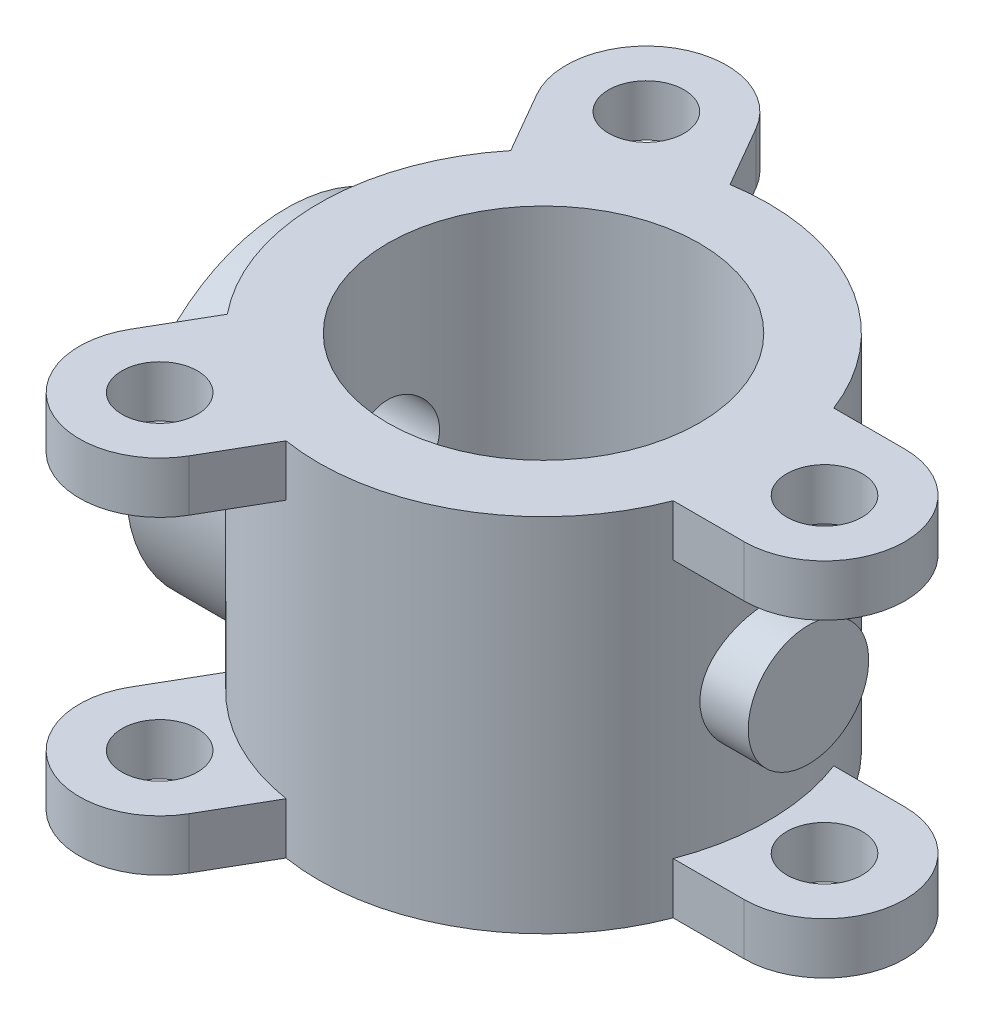
from build123d import *

# Parameters (mm, degrees)
SKETCH1_R               = 23.5
BOSS_EXTRUDE1_DEPTH     = 112.5
SKETCH2_OUTSIDE_W       = 484.702
SKETCH2_OUTSIDE_H       = 522.81
SKETCH2_OUTSIDE_R       = 140
CUT_EXTRUDE2_DEPTH      = 80.5
SKETCH3_R               = 100
BOSS_EXTRUDE2_DEPTH     = 160
SKETCH5_R               = 37.5
BOSS_EXTRUDE3_DEPTH     = 325
SKETCH6_R               = 28.1
CUT_EXTRUDE3_DEPTH      = 310
SKETCH7_R               = 50
CUT_EXTRUDE4_DEPTH      = 25
SKETCH8_R               = 10.15
CUT_EXTRUDE5_DEPTH      = 15
CUT_EXTRUDE6_DEPTH      = 323.343674653
CUT_EXTRUDE6_DEPTH_BACK = 323.343674653
SKETCH9_R               = 97


with BuildPart() as part:
    # Sketch1 → Boss-Extrude1 (new, symmetric)
    with BuildSketch(Plane(origin=(0, 0, 0), x_dir=(1, 0, 0), z_dir=(0, 1, 0))):
        with BuildLine():
            Line((175, 50), (130.766968306, 50))
            ThreePointArc((130.766968306, 50), (70, 121.24355653), (-22.082213964, 138.247516529))
            Line((-22.082213964, 138.247516529), (-44.198729811, 176.554445662))
            ThreePointArc((-44.198729811, 176.554445662), (-112.5, 194.855715852), (-130.801270189, 126.554445662))
            Line((-130.801270189, 126.554445662), (-108.684754342, 88.247516529))
            ThreePointArc((-108.684754342, 88.247516529), (-140, 0), (-108.684754342, -88.247516529))
            Line((-108.684754342, -88.247516529), (-130.801270189, -126.554445662))
            ThreePointArc((-130.801270189, -126.554445662), (-112.5, -194.855715851), (-44.198729811, -176.554445662))
            Line((-44.198729811, -176.554445662), (-22.082213964, -138.247516529))
            ThreePointArc((-22.082213964, -138.247516529), (70, -121.24355653), (130.766968306, -50))
            Line((130.766968306, -50), (175, -50))
            ThreePointArc((175, -50), (225, 0), (175, 50))
        make_face()
        with Locations(Location((175, 0, 0), (0, 0, 270))):
            Circle(SKETCH1_R, mode=Mode.SUBTRACT)
        with Locations(Location((-87.5, 151.554445662, 0), (0, 0, 270))):
            Circle(SKETCH1_R, mode=Mode.SUBTRACT)
        with Locations(Location((-87.5, -151.554445662, 0), (0, 0, 270))):
            Circle(SKETCH1_R, mode=Mode.SUBTRACT)
    extrude(amount=BOSS_EXTRUDE1_DEPTH, both=True)

    # Sketch2 outside → Cut-Extrude2 (cut, symmetric)
    with BuildSketch(Plane(origin=(0, 0, 0), x_dir=(1, 0, 0), z_dir=(0, 1, 0))):
        with Locations((42.5, 0)):
            Rectangle(SKETCH2_OUTSIDE_W, SKETCH2_OUTSIDE_H)
        with Locations(Location((0, 0, 0), (0, 0, 99.075167572))):
            Circle(SKETCH2_OUTSIDE_R, mode=Mode.SUBTRACT)
    extrude(amount=CUT_EXTRUDE2_DEPTH, both=True, mode=Mode.SUBTRACT)

    # Sketch3 → Boss-Extrude2 (add)
    with BuildSketch(Plane(origin=(0, 0, 0), x_dir=(0, 0, -1), z_dir=(1, 0, 0))):
        Circle(SKETCH3_R)
    extrude(amount=-BOSS_EXTRUDE2_DEPTH)

    # Sketch5 → Boss-Extrude3 (add)
    with BuildSketch(Plane.ZY.offset(160)):
        Circle(SKETCH5_R)
    extrude(amount=-BOSS_EXTRUDE3_DEPTH)

    # Sketch6 → Cut-Extrude3 (cut)
    with BuildSketch(Plane.ZY.offset(160)):
        Circle(SKETCH6_R)
    extrude(amount=-CUT_EXTRUDE3_DEPTH, mode=Mode.SUBTRACT)

    # Sketch7 → Cut-Extrude4 (cut)
    with BuildSketch(Plane.ZY.offset(160)):
        Circle(SKETCH7_R)
    extrude(amount=-CUT_EXTRUDE4_DEPTH, mode=Mode.SUBTRACT)

    # Sketch8 → Cut-Extrude5 (cut)
    with BuildSketch(Plane.ZY.offset(160)):
        with Locations((0, 74.921014489)):
            Circle(SKETCH8_R)
        with Locations((64.951905284, -37.578985511)):
            Circle(SKETCH8_R)
        with Locations((-64.951905284, -37.578985511)):
            Circle(SKETCH8_R)
    extrude(amount=-CUT_EXTRUDE5_DEPTH, mode=Mode.SUBTRACT)

    # Sketch9 → Cut-Extrude6 (cut, two sides: drawn at the far end of the back side and taken through both)
    with BuildSketch(Plane(origin=(0, 0, 0), x_dir=(1, 0, 0), z_dir=(0, 1, 0)).offset(-CUT_EXTRUDE6_DEPTH_BACK)):
        with Locations(Location((0, 0, 0), (0, 0, 270))):
            Circle(SKETCH9_R)
    extrude(amount=CUT_EXTRUDE6_DEPTH + CUT_EXTRUDE6_DEPTH_BACK, mode=Mode.SUBTRACT)


solid = part.part
